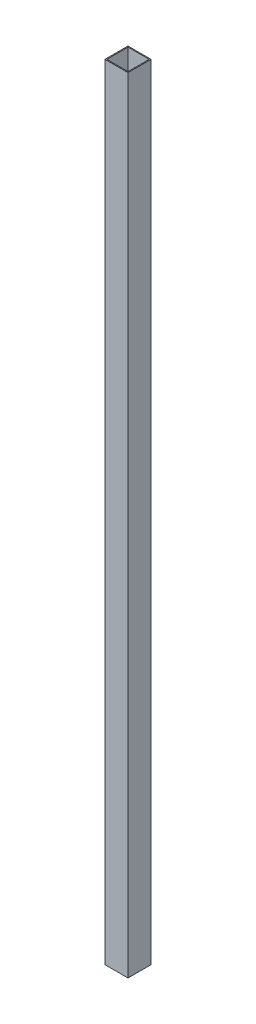
from build123d import *

# Parameters (mm, degrees)
SKETCH1_W           = 50
SKETCH1_H           = 50
SKETCH1_W_2         = 46
SKETCH1_H_2         = 46
BOSS_EXTRUDE1_DEPTH = 1700


with BuildPart() as part:
    # Sketch1 → Boss-Extrude1 (new body)
    with BuildSketch(Plane(origin=(0, 0, 0), x_dir=(1, 0, 0), z_dir=(0, 1, 0))):
        Rectangle(SKETCH1_W, SKETCH1_H)
        Rectangle(SKETCH1_W_2, SKETCH1_H_2, mode=Mode.SUBTRACT)
    extrude(amount=BOSS_EXTRUDE1_DEPTH)


solid = part.part
